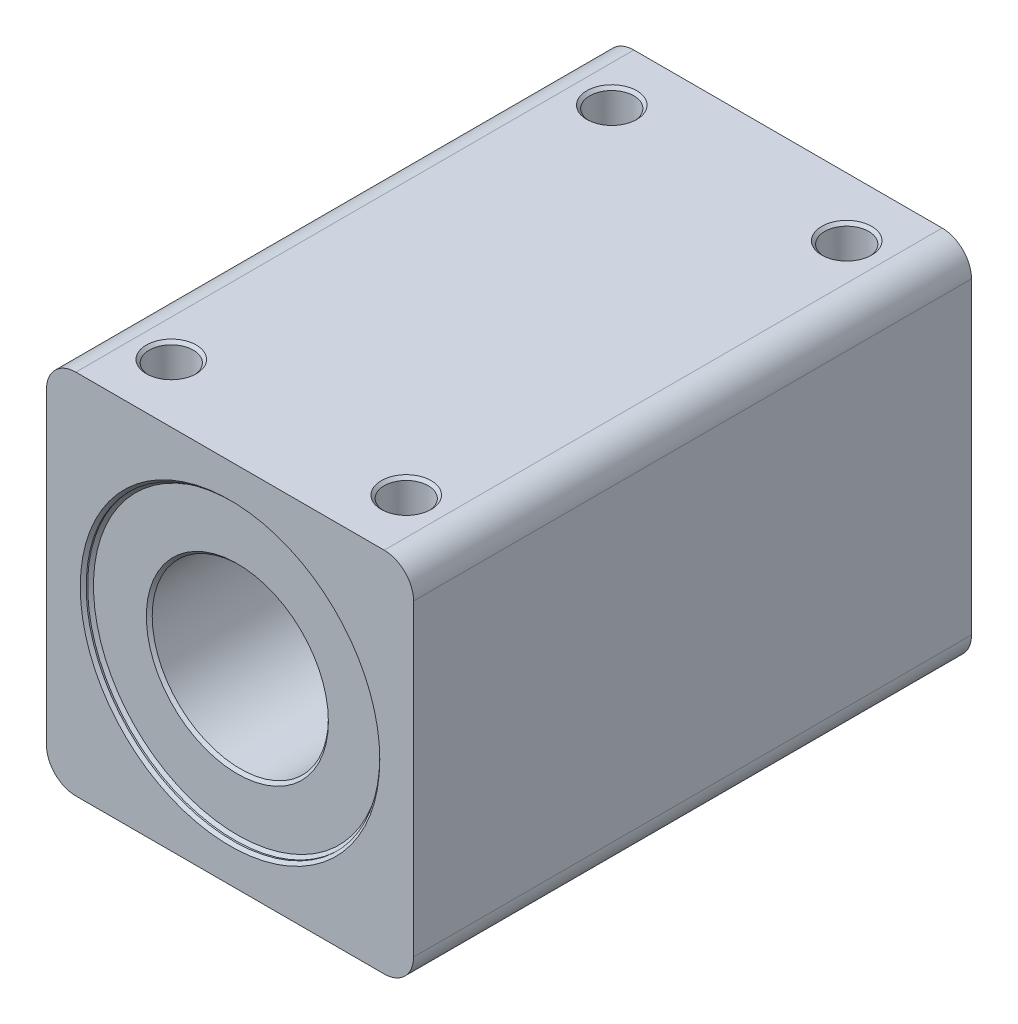
from build123d import *

# Parameters (mm, degrees)
SKETCH1_W          = 25
SKETCH1_H          = 25
SKETCH1_R          = 6
BASE_EXTRUDE_DEPTH = 19
SKETCH2_R          = 10
FRONTDETAIL_DEPTH  = 0.5
FILLET1_R          = 2
SKETCH3_R          = 1.5
MOUNTS_DEPTH       = 4.5
CHAMFER1_SIZE      = 0.2


with BuildPart() as part:
    # Sketch1 → Base-Extrude (new, symmetric)
    with BuildSketch(Plane.XY):
        Rectangle(SKETCH1_W, SKETCH1_H)
        Circle(SKETCH1_R, mode=Mode.SUBTRACT)
    extrude(amount=BASE_EXTRUDE_DEPTH, both=True)

    # Sketch2 → FrontDetail (cut)
    with BuildSketch(Plane.XY.offset(19)):
        Circle(SKETCH2_R)
    frontdetail = extrude(amount=-FRONTDETAIL_DEPTH, mode=Mode.SUBTRACT)

    # Mirror1: FrontDetail across plane
    add(frontdetail.mirror(Plane.XY), mode=Mode.SUBTRACT)

    # Fillet1
    fillet1_edges = [part.edges().sort_by_distance(p)[0] for p in [
        (-12.5, 12.5, 0),
        (12.5, 12.5, 0),
        (12.5, -12.5, 0),
        (-12.5, -12.5, 0),
    ]]
    fillet(fillet1_edges, radius=FILLET1_R)

    # Sketch3 → Mounts (cut)
    with BuildSketch(Plane(origin=(0, 12.5, 0), x_dir=(-1, 0, 0), z_dir=(0, 1, 0))):
        with Locations(Location((-8, 15, 0), (0, 0, 90))):
            Circle(SKETCH3_R)
        with Locations(Location((8, 15, 0), (0, 0, 90))):
            Circle(SKETCH3_R)
        with Locations(Location((-8, -15, 0), (0, 0, 90))):
            Circle(SKETCH3_R)
        with Locations(Location((8, -15, 0), (0, 0, 90))):
            Circle(SKETCH3_R)
    extrude(amount=-MOUNTS_DEPTH, mode=Mode.SUBTRACT)

    # Chamfer1
    chamfer1_edges = [part.edges().sort_by_distance(p)[0] for p in [
        (-10, 0, 18.5),
        (-6, 0, 18.5),
        (-10, 0, 19),
        (-10, 0, -19),
        (-6, 0, -18.5),
        (-10, 0, -18.5),
        (8, 12.5, 13.5),
        (-8, 12.5, 13.5),
        (8, 12.5, -16.5),
        (-8, 12.5, -16.5),
    ]]
    chamfer(chamfer1_edges, length=CHAMFER1_SIZE)


solid = part.part
